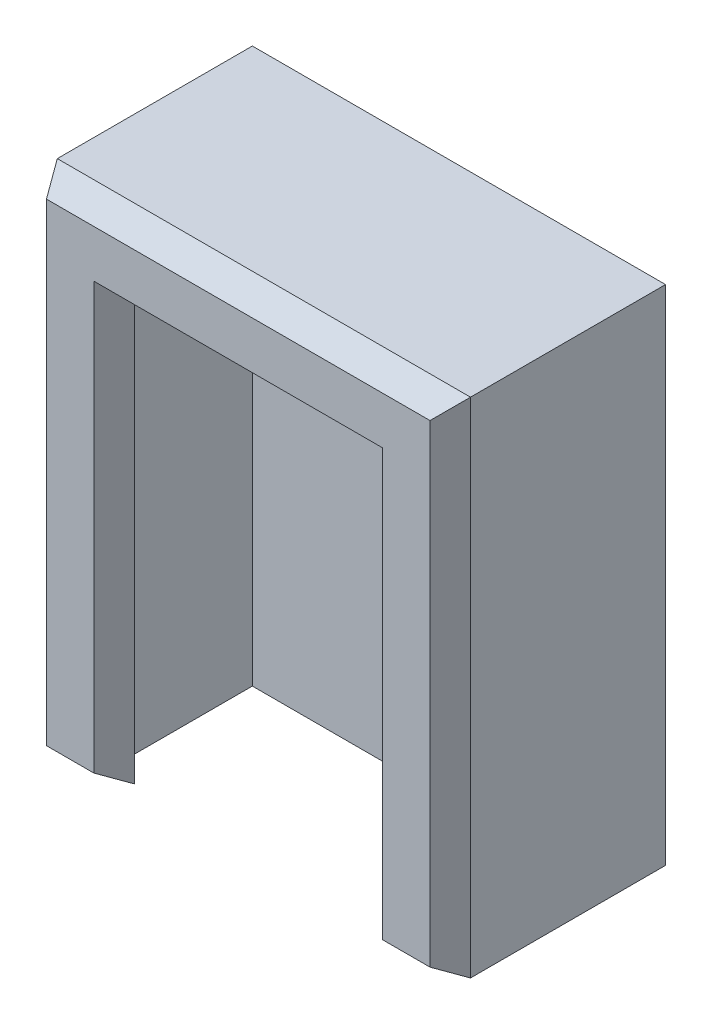
from build123d import *

# Parameters (mm, degrees)
RESSALTO_EXTRUS_O1_DEPTH = 5.6
ESBO_O1_3_W              = 16.1
ESBO_O1_3_H              = 19.6
RESSALTO_EXTRUS_O2_DEPTH = 2
RESSALTO_EXTRUS_O3_DEPTH = 1
RESSALTO_EXTRUS_O3_DRAFT = 30


with BuildPart() as part:
    # Esboço1 → Ressalto-extrusão1 (new body)
    with BuildSketch(Plane.XY):
        Polygon((0, 0), (0, -2), (2, -2), (2, 17.6), (-14.1, 17.6), (-14.1, -2), (-12.1, -2), (-12.1, 0), (-12.1, 15.6), (0, 15.6), align=None)
    extrude(amount=RESSALTO_EXTRUS_O1_DEPTH)

    # Esboço1<3> → Ressalto-extrusão2 (add)
    with BuildSketch(Plane.XY):
        with Locations((-6.05, 7.8)):
            Rectangle(ESBO_O1_3_W, ESBO_O1_3_H)
    extrude(amount=-RESSALTO_EXTRUS_O2_DEPTH)


with BuildPart() as ressalto_extrus_o3_tool:
    # Esboço2 → Ressalto-extrusão3 (with draft: the straight prism first)
    with BuildSketch(Plane.XY.offset(5.6)):
        Polygon((-11.1, -2), (-11.1, 14.6), (-1, 14.6), (-1, -2), (2, -2), (2, 17.6), (-14.1, 17.6), (-14.1, -2), align=None)
    extrude(amount=RESSALTO_EXTRUS_O3_DEPTH)
    # Ressalto-extrusão3: the draft: its side faces are tilted about the plane it starts from
    ressalto_extrus_o3_sides = [ressalto_extrus_o3_tool.faces().sort_by_distance(p)[0] for p in [
        (-6.05, 17.6, 6.1),
        (-14.1, 7.8, 6.1),
        (-12.6, -2, 6.1),
        (-11.1, 6.3, 6.1),
        (-6.05, 14.6, 6.1),
        (-1, 6.3, 6.1),
        (0.5, -2, 6.1),
        (2, 7.8, 6.1),
    ]]
    draft(ressalto_extrus_o3_sides, Plane.XY.offset(5.6), RESSALTO_EXTRUS_O3_DRAFT)


with BuildPart() as part_1:
    add(part.part)

    # Ressalto-extrusão3: add ressalto_extrus_o3_tool
    add(ressalto_extrus_o3_tool.part)


solid = part_1.part
